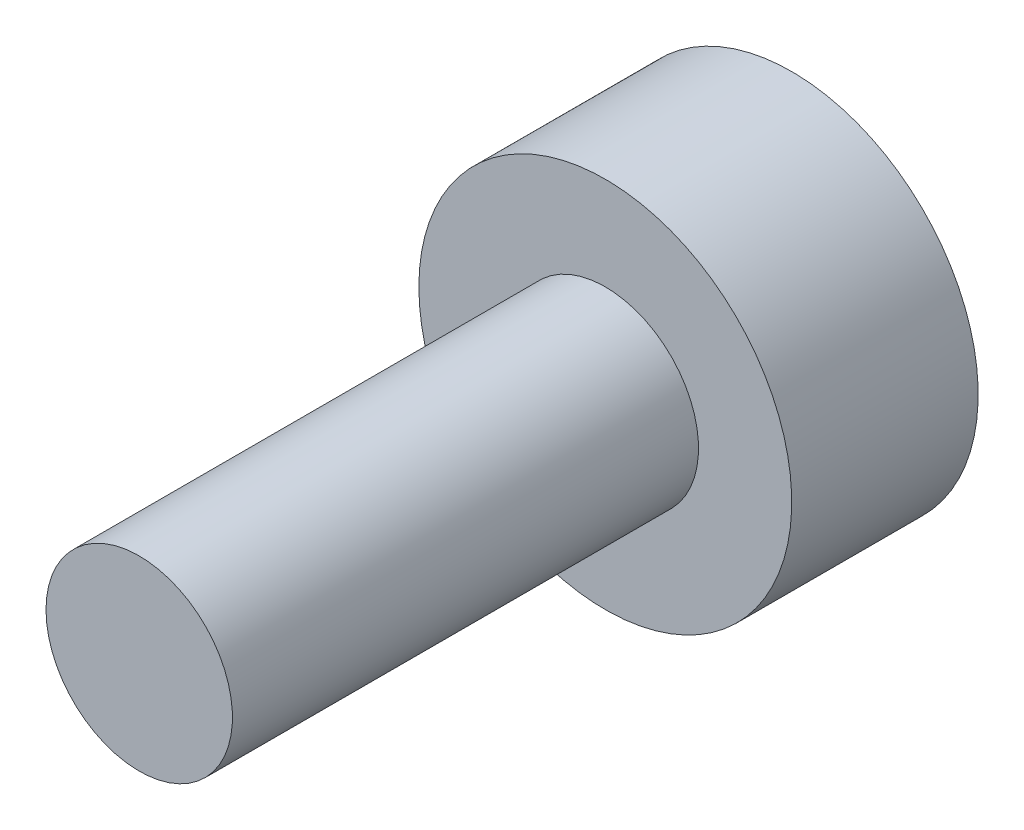
from build123d import *

# Parameters (mm, degrees)
CUT_EXTRUDE1_DEPTH = 1.2


with BuildPart() as part:
    # Sketch1 → Revolve1 (revolve)
    with BuildSketch(Plane(origin=(0, 0, 0), x_dir=(1, 0, 0), z_dir=(0, 1, 0)), mode=Mode.PRIVATE) as revolve1_sk:
        Polygon((0, 0), (1, 0), (1, 5), (2, 5), (2, 7), (0, 7), align=None)
    revolve(revolve1_sk.sketch.rotate(Axis((0, 0, -7), (0, 0, 1)), 180), axis=Axis((0, 0, -7), (0, 0, 1)))

    # Sketch2 → Cut-Extrude1 (cut)
    with BuildSketch(Plane(origin=(0, 0, -7), x_dir=(-1, 0, 0), z_dir=(0, 0, -1))):
        Polygon((0.433012702, 0.75), (-0.433012702, 0.75), (-0.866025404, 0), (-0.433012702, -0.75), (0.433012702, -0.75), (0.866025404, 0), align=None)
    extrude(amount=-CUT_EXTRUDE1_DEPTH, mode=Mode.SUBTRACT)


solid = part.part
